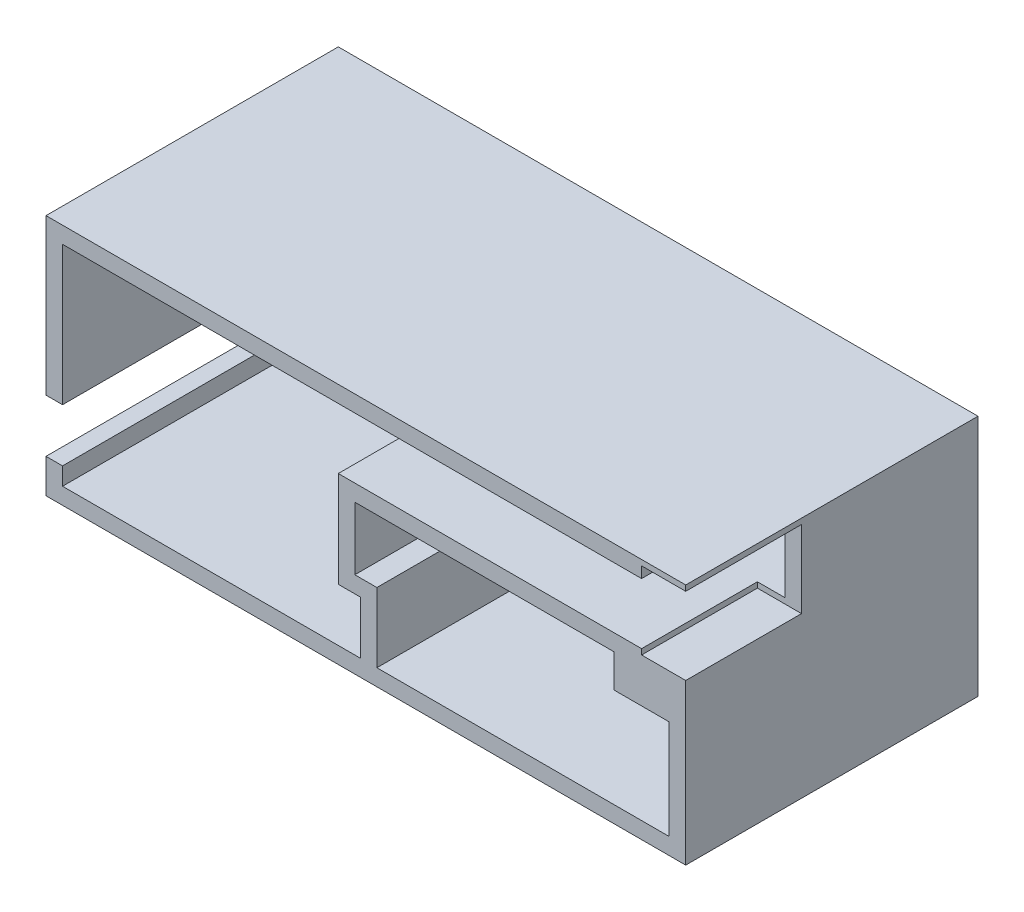
from build123d import *

# Parameters (mm, degrees)
SKETCH1_W           = 58
SKETCH1_H           = 22
BOSS_EXTRUDE1_DEPTH = 1.5
SKETCH2_W           = 58
SKETCH2_H           = 22
BOSS_EXTRUDE2_DEPTH = 25
CUT_EXTRUDE1_DEPTH  = 5
SKETCH6_W           = 10.5
SKETCH6_H           = 7
CUT_EXTRUDE2_DEPTH  = 4


with BuildPart() as part:
    # Sketch1 → Boss-Extrude1 (new body)
    with BuildSketch(Plane.XY):
        with Locations((9.718487395, 11)):
            Rectangle(SKETCH1_W, SKETCH1_H)
    extrude(amount=BOSS_EXTRUDE1_DEPTH)

    # Sketch2 → Boss-Extrude2 (add)
    with BuildSketch(Plane.XY.offset(1.5)):
        with Locations((9.718487395, 11)):
            Rectangle(SKETCH2_W, SKETCH2_H)
        Polygon((-17.781512605, 20.5), (-17.781512605, 1.5), (9.218487395, 1.5), (9.218487395, 6.3), (7.218487395, 6.3), (7.218487395, 15), (37.218487395, 15), (37.218487395, 20.5), align=None, mode=Mode.SUBTRACT)
        Polygon((37.218487395, 1.5), (37.218487395, 10.5), (32.218487395, 10.5), (32.218487395, 13.5), (8.718487395, 13.5), (8.718487395, 7.8), (10.718487395, 7.8), (10.718487395, 1.5), align=None, mode=Mode.SUBTRACT)
    extrude(amount=BOSS_EXTRUDE2_DEPTH)

    # Sketch3 → Cut-Extrude1 (cut)
    with BuildSketch(Plane.ZY.offset(19.281512605)):
        Polygon((7.25, 3.1), (19.25, 3.1), (26.5, 3.1), (26.5, 7.9), (19.25, 7.9), (7.25, 7.9), align=None)
    extrude(amount=-CUT_EXTRUDE1_DEPTH, mode=Mode.SUBTRACT)

    # Sketch6 → Cut-Extrude2 (cut)
    with BuildSketch(Plane(origin=(38.718487395, 0, 0), x_dir=(0, 0, -1), z_dir=(1, 0, 0))):
        with Locations((-21.25, 18)):
            Rectangle(SKETCH6_W, SKETCH6_H)
    extrude(amount=-CUT_EXTRUDE2_DEPTH, mode=Mode.SUBTRACT)


solid = part.part
